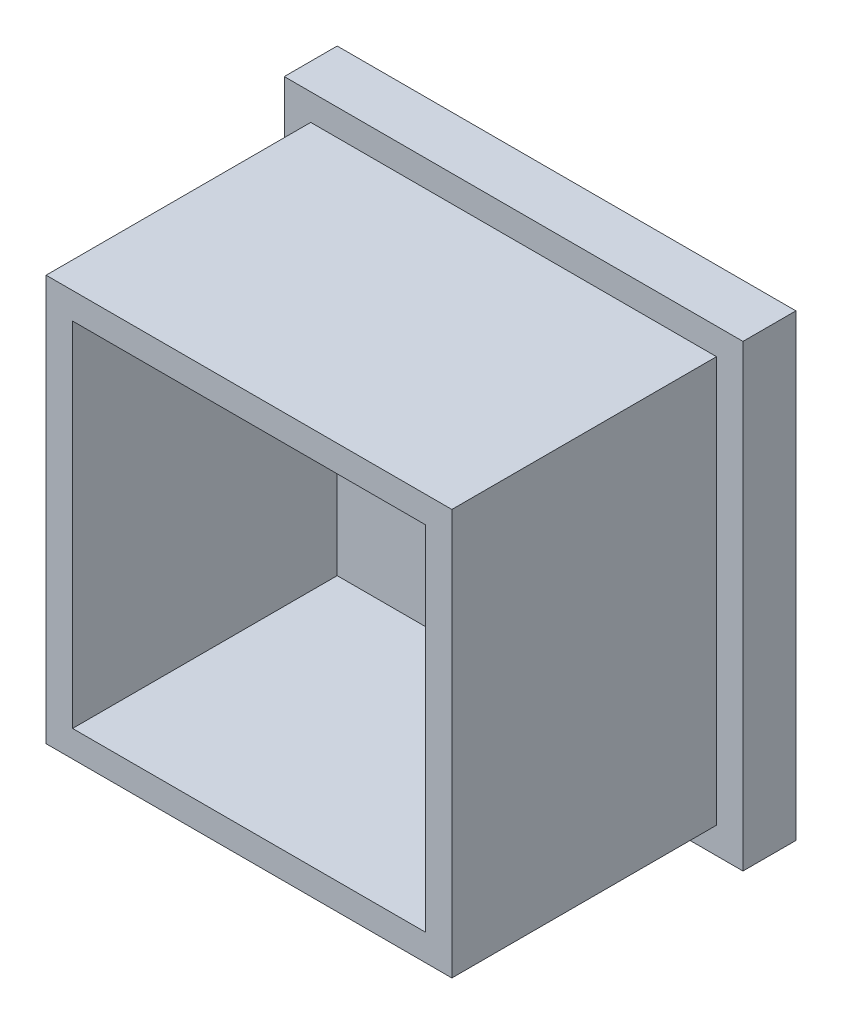
from build123d import *

# Parameters (mm, degrees)
CROQUIS1_W              = 26
CROQUIS1_H              = 26
SALIENTE_EXTRUIR1_DEPTH = 3
CROQUIS2_W              = 23
CROQUIS2_H              = 23
CROQUIS2_W_2            = 20
CROQUIS2_H_2            = 20
SALIENTE_EXTRUIR2_DEPTH = 15


with BuildPart() as part:
    # Croquis1 → Saliente-Extruir1 (new body)
    with BuildSketch(Plane.XY):
        with Locations((13, -13)):
            Rectangle(CROQUIS1_W, CROQUIS1_H)
    extrude(amount=SALIENTE_EXTRUIR1_DEPTH)

    # Croquis2 → Saliente-Extruir2 (add)
    with BuildSketch(Plane.XY.offset(3)):
        with Locations((13, -13)):
            Rectangle(CROQUIS2_W, CROQUIS2_H)
        with Locations((13, -13)):
            Rectangle(CROQUIS2_W_2, CROQUIS2_H_2, mode=Mode.SUBTRACT)
    extrude(amount=SALIENTE_EXTRUIR2_DEPTH)


solid = part.part
